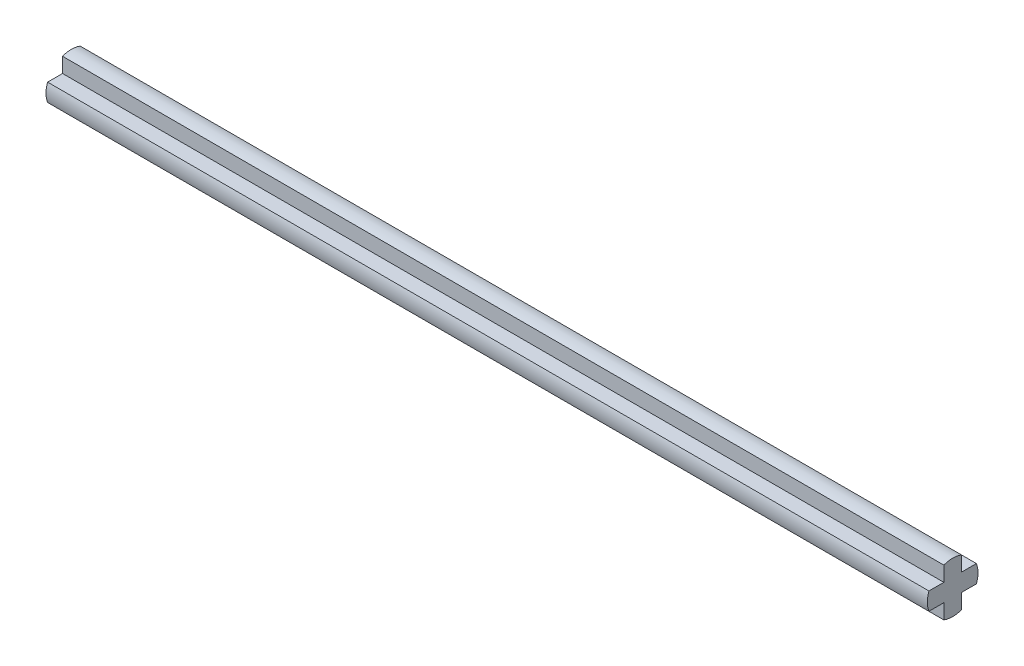
from build123d import *

# Parameters (mm, degrees)
BOSS_EXTRUDE1_DEPTH = 80


with BuildPart() as part:
    # Sketch1 → Boss-Extrude1 (new body)
    with BuildSketch(Plane(origin=(0, 0, 0), x_dir=(0, 0, -1), z_dir=(1, 0, 0))):
        with BuildLine():
            Line((-2.156385865, 0.8), (-0.8, 0.8))
            Line((-0.8, 0.8), (-0.8, 2.156385865))
            add(Edge.make_bspline(
                [(-0.8, 2.156385865), (0, 2.443614135), (0.8, 2.156385865)],
                knots=[0, 0, 0, 1, 1, 1], degree=2))
            Line((0.8, 2.156385865), (0.8, 0.8))
            Line((0.8, 0.8), (2.156385865, 0.8))
            add(Edge.make_bspline(
                [(2.156385865, 0.8), (2.443614135, 0), (2.156385865, -0.8)],
                knots=[0, 0, 0, 1, 1, 1], degree=2))
            Line((2.156385865, -0.8), (0.8, -0.8))
            Line((0.8, -0.8), (0.8, -2.156385865))
            add(Edge.make_bspline(
                [(0.8, -2.156385865), (0, -2.443614135), (-0.8, -2.156385865)],
                knots=[0, 0, 0, 1, 1, 1], degree=2))
            Line((-0.8, -2.156385865), (-0.8, -0.8))
            Line((-0.8, -0.8), (-2.156385865, -0.8))
            add(Edge.make_bspline(
                [(-2.156385865, -0.8), (-2.443614135, 0), (-2.156385865, 0.8)],
                knots=[0, 0, 0, 1, 1, 1], degree=2))
        make_face()
    extrude(amount=BOSS_EXTRUDE1_DEPTH)


solid = part.part
